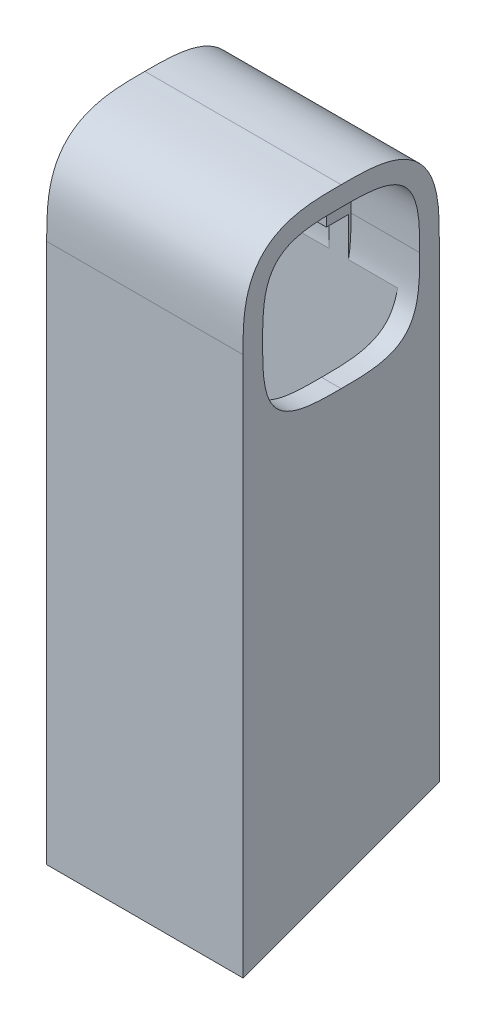
from build123d import *

# Parameters (mm, degrees)
EXTRUDE_1_DEPTH     = 20
CUT_EXTRUDE_2_DEPTH = 11
SKETCH_6_W          = 1.9
SKETCH_6_H          = 1.5
SKETCH_6_W_2        = 1.5
SKETCH_6_H_2        = 1.9
EXTRUDE_6_DEPTH     = 11
CUT_EXTRUDE_3_DEPTH = 7
CUT_EXTRUDE_4_REACH = 59.393
SKETCH_9_W          = 16
SKETCH_9_H          = 15.500151224
CUT_EXTRUDE_5_DEPTH = 60.371723314
CUT_EXTRUDE_8_DEPTH = 1.5


with BuildPart() as part:
    # 草图1 → 凸台-拉伸1 (new body)
    with BuildSketch(Plane(origin=(0, 0, 0), x_dir=(0, 0, -1), z_dir=(1, 0, 0))):
        with BuildLine():
            Line((-10, 0), (-10, -55))
            Line((-10, -55), (10, -47.720595315))
            Line((10, -47.720595315), (10, 0))
            add(Edge.make_bspline(
                [(0, 10), (0.247453809, 10), (0.758303869, 10.000016016), (1.603055308, 9.994226508), (2.593577785, 9.952211719), (3.530353928, 9.865080166), (4.284627123, 9.739256424), (4.922082116, 9.592557226), (5.422764466, 9.444615932), (5.916551912, 9.264259241), (6.394575911, 9.04867722), (6.85460463, 8.795726536), (7.271227663, 8.517584497), (7.628568885, 8.232402828), (7.946779887, 7.93562621), (8.242746957, 7.616644854), (8.528140684, 7.256833204), (8.806024166, 6.837508212), (9.057530382, 6.376839102), (9.271724392, 5.897795987), (9.450800041, 5.404655749), (9.597547811, 4.901036284), (9.744407354, 4.263402914), (9.88839272, 3.36833547), (9.983457728, 2.203757849), (9.999712963, 1.167546065), (10.000298818, 0.392340904), (10, 0)],
                knots=[0.055983789, 0.055983789, 0.055983789, 0.055983789, 0.055983789, 0.114683051, 0.173382311, 0.232081567, 0.289095869, 0.31844553, 0.347795109, 0.377144683, 0.406494377, 0.435843931, 0.465193379, 0.494543078, 0.518534158, 0.53810056, 0.562554518, 0.591904776, 0.621253575, 0.650602493, 0.679952998, 0.709301255, 0.738647221, 0.767998334, 0.826406107, 0.912140354, 1, 1, 1, 1, 1], degree=4))
            add(Edge.make_bspline(
                [(0, 10), (-0.247453809, 10), (-0.758303869, 10.000016016), (-1.603055308, 9.994226508), (-2.593577785, 9.952211719), (-3.530353928, 9.865080166), (-4.284627123, 9.739256424), (-4.922082116, 9.592557226), (-5.422764466, 9.444615932), (-5.916551912, 9.264259241), (-6.394575911, 9.04867722), (-6.85460463, 8.795726536), (-7.271227663, 8.517584497), (-7.628568885, 8.232402828), (-7.946779887, 7.93562621), (-8.242746957, 7.616644854), (-8.528140684, 7.256833204), (-8.806024166, 6.837508212), (-9.057530382, 6.376839102), (-9.271724392, 5.897795987), (-9.450800041, 5.404655749), (-9.597547811, 4.901036284), (-9.744407354, 4.263402914), (-9.88839272, 3.36833547), (-9.983457728, 2.203757849), (-9.999712963, 1.167546065), (-10.000298818, 0.392340904), (-10, 0)],
                knots=[0.055983789, 0.055983789, 0.055983789, 0.055983789, 0.055983789, 0.114683051, 0.173382311, 0.232081567, 0.289095869, 0.31844553, 0.347795109, 0.377144683, 0.406494377, 0.435843931, 0.465193379, 0.494543078, 0.518534158, 0.53810056, 0.562554518, 0.591904776, 0.621253575, 0.650602493, 0.679952998, 0.709301255, 0.738647221, 0.767998334, 0.826406107, 0.912140354, 1, 1, 1, 1, 1], degree=4))
        make_face()
    extrude(amount=EXTRUDE_1_DEPTH)

    # 草图4 → 切除-拉伸2 (cut)
    with BuildSketch(Plane.ZY):
        with BuildLine():
            add(Edge.make_bspline(
                [(0, -7.996953489), (0.165849782, -7.996953489), (0.334100831, -7.996954735), (0.676866623, -7.996002401), (0.851430156, -7.995047824), (1.198537621, -7.991293894), (1.370157566, -7.988495505), (1.702190157, -7.980267252), (1.862506084, -7.974848338), (2.177562438, -7.96056796), (2.333320862, -7.951688486), (2.645739013, -7.929639119), (2.802433419, -7.916449368), (3.110230223, -7.885378254), (3.260513804, -7.867542872), (3.55196969, -7.8266977), (3.693151717, -7.803723475), (3.975098189, -7.751014368), (4.116547995, -7.721164453), (4.388453231, -7.656261221), (4.51821518, -7.621337701), (4.773512811, -7.543946599), (4.899417217, -7.501387248), (5.141652363, -7.410259771), (5.257907453, -7.361714456), (5.820499722, -7.101159966), (6.203019186, -6.83951841), (6.842559245, -6.19997618), (7.103874532, -5.818228617), (7.52127465, -4.916762245), (7.675014245, -4.398425284), (7.885017485, -3.268209366), (7.942065616, -2.657066463), (7.999332194, -1.373354731), (8.000532588, -0.696991406), (8.00000058, 0.001523255)],
                knots=[0, 0, 0, 0, 0.03125, 0.03125, 0.0625, 0.0625, 0.09375, 0.09375, 0.125, 0.125, 0.15625, 0.15625, 0.1875, 0.1875, 0.21875, 0.21875, 0.25, 0.25, 0.28125, 0.28125, 0.3125, 0.3125, 0.34375, 0.34375, 0.375, 0.375, 0.5, 0.5, 0.625, 0.625, 0.75, 0.75, 0.875, 0.875, 1, 1, 1, 1], degree=3))
            add(Edge.make_bspline(
                [(0, 8), (0.165849782, 8), (0.334100831, 8.000001246), (0.676866623, 7.999048912), (0.851430156, 7.998094335), (1.198537621, 7.994340405), (1.370157566, 7.991542016), (1.702190157, 7.983313763), (1.862506084, 7.977894849), (2.177562438, 7.963614471), (2.333320862, 7.954734997), (2.645739013, 7.93268563), (2.802433419, 7.919495879), (3.110230223, 7.888424765), (3.260513804, 7.870589383), (3.55196969, 7.829744211), (3.693151717, 7.806769986), (3.975098189, 7.754060879), (4.116547995, 7.724210964), (4.388453231, 7.659307732), (4.51821518, 7.624384212), (4.773512811, 7.54699311), (4.899417217, 7.504433758), (5.141652363, 7.413306281), (5.257907453, 7.364760967), (5.820499722, 7.104206477), (6.203019186, 6.842564921), (6.842559245, 6.203022691), (7.103874532, 5.821275128), (7.52127465, 4.919808756), (7.675014245, 4.401471794), (7.885017485, 3.271255877), (7.942065616, 2.660112974), (7.999332194, 1.376401242), (8.000532588, 0.700037917), (8.00000058, 0.001523255)],
                knots=[0, 0, 0, 0, 0.03125, 0.03125, 0.0625, 0.0625, 0.09375, 0.09375, 0.125, 0.125, 0.15625, 0.15625, 0.1875, 0.1875, 0.21875, 0.21875, 0.25, 0.25, 0.28125, 0.28125, 0.3125, 0.3125, 0.34375, 0.34375, 0.375, 0.375, 0.5, 0.5, 0.625, 0.625, 0.75, 0.75, 0.875, 0.875, 1, 1, 1, 1], degree=3))
            add(Edge.make_bspline(
                [(-8.00000058, 0.001523255), (-8.000532588, 0.700037917), (-7.999332194, 1.376401242), (-7.942065616, 2.660112974), (-7.885017485, 3.271255877), (-7.675014245, 4.401471794), (-7.52127465, 4.919808756), (-7.103874532, 5.821275128), (-6.842559245, 6.203022691), (-6.203019186, 6.842564921), (-5.820499722, 7.104206477), (-5.257907453, 7.364760967), (-5.141652363, 7.413306281), (-4.899417217, 7.504433758), (-4.773512811, 7.54699311), (-4.51821518, 7.624384212), (-4.388453231, 7.659307732), (-4.116547995, 7.724210964), (-3.975098189, 7.754060879), (-3.693151717, 7.806769986), (-3.55196969, 7.829744211), (-3.260513804, 7.870589383), (-3.110230223, 7.888424765), (-2.802433419, 7.919495879), (-2.645739013, 7.93268563), (-2.333320862, 7.954734997), (-2.177562438, 7.963614471), (-1.862506084, 7.977894849), (-1.702190157, 7.983313763), (-1.370157566, 7.991542016), (-1.198537621, 7.994340405), (-0.851430156, 7.998094335), (-0.676866623, 7.999048912), (-0.334100831, 8.000001246), (-0.165849782, 8), (0, 8)],
                knots=[0, 0, 0, 0, 0.125, 0.125, 0.25, 0.25, 0.375, 0.375, 0.5, 0.5, 0.625, 0.625, 0.65625, 0.65625, 0.6875, 0.6875, 0.71875, 0.71875, 0.75, 0.75, 0.78125, 0.78125, 0.8125, 0.8125, 0.84375, 0.84375, 0.875, 0.875, 0.90625, 0.90625, 0.9375, 0.9375, 0.96875, 0.96875, 1, 1, 1, 1], degree=3))
            add(Edge.make_bspline(
                [(-8.00000058, 0.001523255), (-8.000532588, -0.696991406), (-7.999332194, -1.373354731), (-7.942065616, -2.657066463), (-7.885017485, -3.268209366), (-7.675014245, -4.398425284), (-7.52127465, -4.916762245), (-7.103874532, -5.818228617), (-6.842559245, -6.19997618), (-6.203019186, -6.83951841), (-5.820499722, -7.101159966), (-5.257907453, -7.361714456), (-5.141652363, -7.410259771), (-4.899417217, -7.501387248), (-4.773512811, -7.543946599), (-4.51821518, -7.621337701), (-4.388453231, -7.656261221), (-4.116547995, -7.721164453), (-3.975098189, -7.751014368), (-3.693151717, -7.803723475), (-3.55196969, -7.8266977), (-3.260513804, -7.867542872), (-3.110230223, -7.885378254), (-2.802433419, -7.916449368), (-2.645739013, -7.929639119), (-2.333320862, -7.951688486), (-2.177562438, -7.96056796), (-1.862506084, -7.974848338), (-1.702190157, -7.980267252), (-1.370157566, -7.988495505), (-1.198537621, -7.991293894), (-0.851430156, -7.995047824), (-0.676866623, -7.996002401), (-0.334100831, -7.996954735), (-0.165849782, -7.996953489), (0, -7.996953489)],
                knots=[0, 0, 0, 0, 0.125, 0.125, 0.25, 0.25, 0.375, 0.375, 0.5, 0.5, 0.625, 0.625, 0.65625, 0.65625, 0.6875, 0.6875, 0.71875, 0.71875, 0.75, 0.75, 0.78125, 0.78125, 0.8125, 0.8125, 0.84375, 0.84375, 0.875, 0.875, 0.90625, 0.90625, 0.9375, 0.9375, 0.96875, 0.96875, 1, 1, 1, 1], degree=3))
        make_face()
    extrude(amount=-CUT_EXTRUDE_2_DEPTH, mode=Mode.SUBTRACT)

    # 草图6 → 凸台-拉伸6 (add)
    with BuildSketch(Plane.ZY):
        with Locations((0, 7.75)):
            Rectangle(SKETCH_6_W, SKETCH_6_H)
        with Locations((7.75, 0)):
            Rectangle(SKETCH_6_W_2, SKETCH_6_H_2)
        with Locations((0, -7.75)):
            Rectangle(SKETCH_6_W, SKETCH_6_H)
        with Locations((-7.75, 0)):
            Rectangle(SKETCH_6_W_2, SKETCH_6_H_2)
    extrude(amount=-EXTRUDE_6_DEPTH)

    # 草图7 → 切除-拉伸3 (cut)
    with BuildSketch(Plane(origin=(20, 0, 0), x_dir=(0, 0, -1), z_dir=(1, 0, 0))):
        with BuildLine():
            add(Edge.make_bspline(
                [(0, -7.996953489), (-0.165849782, -7.996953489), (-0.334100831, -7.996954735), (-0.676866623, -7.996002401), (-0.851430156, -7.995047824), (-1.198537621, -7.991293894), (-1.370157566, -7.988495505), (-1.702190157, -7.980267252), (-1.862506084, -7.974848338), (-2.177562438, -7.96056796), (-2.333320862, -7.951688486), (-2.645739013, -7.929639119), (-2.802433419, -7.916449368), (-3.110230223, -7.885378254), (-3.260513804, -7.867542872), (-3.55196969, -7.8266977), (-3.693151717, -7.803723475), (-3.975098189, -7.751014368), (-4.116547995, -7.721164453), (-4.388453231, -7.656261221), (-4.51821518, -7.621337701), (-4.773512811, -7.543946599), (-4.899417217, -7.501387248), (-5.141652363, -7.410259771), (-5.257907453, -7.361714456), (-5.820499722, -7.101159966), (-6.203019186, -6.83951841), (-6.842559245, -6.19997618), (-7.103874532, -5.818228617), (-7.52127465, -4.916762245), (-7.675014245, -4.398425284), (-7.885017485, -3.268209366), (-7.942065616, -2.657066463), (-7.999332194, -1.373354731), (-8.000532588, -0.696991406), (-8.00000058, 0.001523255)],
                knots=[0, 0, 0, 0, 0.03125, 0.03125, 0.0625, 0.0625, 0.09375, 0.09375, 0.125, 0.125, 0.15625, 0.15625, 0.1875, 0.1875, 0.21875, 0.21875, 0.25, 0.25, 0.28125, 0.28125, 0.3125, 0.3125, 0.34375, 0.34375, 0.375, 0.375, 0.5, 0.5, 0.625, 0.625, 0.75, 0.75, 0.875, 0.875, 1, 1, 1, 1], degree=3))
            add(Edge.make_bspline(
                [(0, 8), (-0.165849782, 8), (-0.334100831, 8.000001246), (-0.676866623, 7.999048912), (-0.851430156, 7.998094335), (-1.198537621, 7.994340405), (-1.370157566, 7.991542016), (-1.702190157, 7.983313763), (-1.862506084, 7.977894849), (-2.177562438, 7.963614471), (-2.333320862, 7.954734997), (-2.645739013, 7.93268563), (-2.802433419, 7.919495879), (-3.110230223, 7.888424765), (-3.260513804, 7.870589383), (-3.55196969, 7.829744211), (-3.693151717, 7.806769986), (-3.975098189, 7.754060879), (-4.116547995, 7.724210964), (-4.388453231, 7.659307732), (-4.51821518, 7.624384212), (-4.773512811, 7.54699311), (-4.899417217, 7.504433758), (-5.141652363, 7.413306281), (-5.257907453, 7.364760967), (-5.820499722, 7.104206477), (-6.203019186, 6.842564921), (-6.842559245, 6.203022691), (-7.103874532, 5.821275128), (-7.52127465, 4.919808756), (-7.675014245, 4.401471794), (-7.885017485, 3.271255877), (-7.942065616, 2.660112974), (-7.999332194, 1.376401242), (-8.000532588, 0.700037917), (-8.00000058, 0.001523255)],
                knots=[0, 0, 0, 0, 0.03125, 0.03125, 0.0625, 0.0625, 0.09375, 0.09375, 0.125, 0.125, 0.15625, 0.15625, 0.1875, 0.1875, 0.21875, 0.21875, 0.25, 0.25, 0.28125, 0.28125, 0.3125, 0.3125, 0.34375, 0.34375, 0.375, 0.375, 0.5, 0.5, 0.625, 0.625, 0.75, 0.75, 0.875, 0.875, 1, 1, 1, 1], degree=3))
            add(Edge.make_bspline(
                [(8.00000058, 0.001523255), (8.000532588, 0.700037917), (7.999332194, 1.376401242), (7.942065616, 2.660112974), (7.885017485, 3.271255877), (7.675014245, 4.401471794), (7.52127465, 4.919808756), (7.103874532, 5.821275128), (6.842559245, 6.203022691), (6.203019186, 6.842564921), (5.820499722, 7.104206477), (5.257907453, 7.364760967), (5.141652363, 7.413306281), (4.899417217, 7.504433758), (4.773512811, 7.54699311), (4.51821518, 7.624384212), (4.388453231, 7.659307732), (4.116547995, 7.724210964), (3.975098189, 7.754060879), (3.693151717, 7.806769986), (3.55196969, 7.829744211), (3.260513804, 7.870589383), (3.110230223, 7.888424765), (2.802433419, 7.919495879), (2.645739013, 7.93268563), (2.333320862, 7.954734997), (2.177562438, 7.963614471), (1.862506084, 7.977894849), (1.702190157, 7.983313763), (1.370157566, 7.991542016), (1.198537621, 7.994340405), (0.851430156, 7.998094335), (0.676866623, 7.999048912), (0.334100831, 8.000001246), (0.165849782, 8), (0, 8)],
                knots=[0, 0, 0, 0, 0.125, 0.125, 0.25, 0.25, 0.375, 0.375, 0.5, 0.5, 0.625, 0.625, 0.65625, 0.65625, 0.6875, 0.6875, 0.71875, 0.71875, 0.75, 0.75, 0.78125, 0.78125, 0.8125, 0.8125, 0.84375, 0.84375, 0.875, 0.875, 0.90625, 0.90625, 0.9375, 0.9375, 0.96875, 0.96875, 1, 1, 1, 1], degree=3))
            add(Edge.make_bspline(
                [(8.00000058, 0.001523255), (8.000532588, -0.696991406), (7.999332194, -1.373354731), (7.942065616, -2.657066463), (7.885017485, -3.268209366), (7.675014245, -4.398425284), (7.52127465, -4.916762245), (7.103874532, -5.818228617), (6.842559245, -6.19997618), (6.203019186, -6.83951841), (5.820499722, -7.101159966), (5.257907453, -7.361714456), (5.141652363, -7.410259771), (4.899417217, -7.501387248), (4.773512811, -7.543946599), (4.51821518, -7.621337701), (4.388453231, -7.656261221), (4.116547995, -7.721164453), (3.975098189, -7.751014368), (3.693151717, -7.803723475), (3.55196969, -7.8266977), (3.260513804, -7.867542872), (3.110230223, -7.885378254), (2.802433419, -7.916449368), (2.645739013, -7.929639119), (2.333320862, -7.951688486), (2.177562438, -7.96056796), (1.862506084, -7.974848338), (1.702190157, -7.980267252), (1.370157566, -7.988495505), (1.198537621, -7.991293894), (0.851430156, -7.995047824), (0.676866623, -7.996002401), (0.334100831, -7.996954735), (0.165849782, -7.996953489), (0, -7.996953489)],
                knots=[0, 0, 0, 0, 0.125, 0.125, 0.25, 0.25, 0.375, 0.375, 0.5, 0.5, 0.625, 0.625, 0.65625, 0.65625, 0.6875, 0.6875, 0.71875, 0.71875, 0.75, 0.75, 0.78125, 0.78125, 0.8125, 0.8125, 0.84375, 0.84375, 0.875, 0.875, 0.90625, 0.90625, 0.9375, 0.9375, 0.96875, 0.96875, 1, 1, 1, 1], degree=3))
        make_face()
    extrude(amount=-CUT_EXTRUDE_3_DEPTH, mode=Mode.SUBTRACT)

    # 草图8 → 切除-拉伸4 (cut, up to next)
    with BuildSketch(Plane(origin=(13, 0, 0), x_dir=(0, 0, -1), z_dir=(1, 0, 0)), mode=Mode.PRIVATE) as cut_extrude_4_sk1:
        with BuildLine():
            add(Edge.make_bspline(
                [(0, -5.496953489), (0.408323854, -5.496953489), (0.816649183, -5.496980384), (1.632558406, -5.483517843), (2.04010607, -5.469367928), (2.853186705, -5.404340333), (3.261163856, -5.354180846), (3.860915877, -5.2123938), (4.058982713, -5.153100152), (4.342439843, -5.032838865), (4.434164209, -4.987473164), (4.608772051, -4.879841457), (4.692107393, -4.816366101), (4.906070953, -4.597714848), (5.006672586, -4.412639171), (5.162636836, -4.035364697), (5.220663184, -3.837104239), (5.360521218, -3.241025217), (5.408720727, -2.838819195), (5.472861875, -2.030954975), (5.486446534, -1.625043857), (5.50029496, -0.811798767), (5.50030958, -0.405138638), (5.499999855, 0.001523255)],
                knots=[0, 0, 0, 0, 0.125, 0.125, 0.25, 0.25, 0.375, 0.375, 0.4375, 0.4375, 0.46875, 0.46875, 0.5, 0.5, 0.5625, 0.5625, 0.625, 0.625, 0.75, 0.75, 0.875, 0.875, 1, 1, 1, 1], degree=3))
            add(Edge.make_bspline(
                [(5.499999855, 0.001523255), (5.500310914, 0.409936453), (5.500293232, 0.818331597), (5.486281535, 1.634354367), (5.472561165, 2.041997019), (5.407318554, 2.855206409), (5.357729545, 3.263498546), (5.214392423, 3.862800329), (5.155309817, 4.060912843), (5.035011511, 4.344289922), (4.989594474, 4.435968943), (4.881787257, 4.610453538), (4.81813301, 4.693626143), (4.599116112, 4.907137264), (4.413953309, 5.007504353), (4.036701836, 5.163387706), (3.83850139, 5.22154176), (3.242244432, 5.359958319), (2.840122101, 5.408736163), (2.032314196, 5.472725182), (1.626499315, 5.486718254), (0.81331153, 5.500027414), (0.40664695, 5.5), (0, 5.5)],
                knots=[0, 0, 0, 0, 0.125, 0.125, 0.25, 0.25, 0.375, 0.375, 0.4375, 0.4375, 0.46875, 0.46875, 0.5, 0.5, 0.5625, 0.5625, 0.625, 0.625, 0.75, 0.75, 0.875, 0.875, 1, 1, 1, 1], degree=3))
            add(Edge.make_bspline(
                [(0, 5.5), (-0.408323854, 5.5), (-0.816649183, 5.500026895), (-1.632558406, 5.486564354), (-2.04010607, 5.472414439), (-2.853186705, 5.407386844), (-3.261163855, 5.357227357), (-3.860915877, 5.21544031), (-4.058982713, 5.156146663), (-4.342439843, 5.035885376), (-4.434164209, 4.990519675), (-4.608772051, 4.882887968), (-4.692107393, 4.819412612), (-4.906070953, 4.600761359), (-5.006672586, 4.415685682), (-5.162636836, 4.038411208), (-5.220663184, 3.84015075), (-5.360521218, 3.244071728), (-5.408720727, 2.841865706), (-5.472861875, 2.034001486), (-5.486446534, 1.628090368), (-5.50029496, 0.814845277), (-5.50030958, 0.408185149), (-5.499999855, 0.001523255)],
                knots=[0, 0, 0, 0, 0.125, 0.125, 0.25, 0.25, 0.375, 0.375, 0.4375, 0.4375, 0.46875, 0.46875, 0.5, 0.5, 0.5625, 0.5625, 0.625, 0.625, 0.75, 0.75, 0.875, 0.875, 1, 1, 1, 1], degree=3))
            add(Edge.make_bspline(
                [(-5.499999855, 0.001523255), (-5.500310914, -0.406889942), (-5.500293232, -0.815285086), (-5.486281535, -1.631307856), (-5.472561165, -2.038950508), (-5.407318554, -2.852159898), (-5.357729545, -3.260452035), (-5.214392423, -3.859753818), (-5.155309817, -4.057866332), (-5.035011511, -4.341243411), (-4.989594474, -4.432922432), (-4.881787257, -4.607407027), (-4.81813301, -4.690579632), (-4.599116112, -4.904090753), (-4.413953309, -5.004457842), (-4.036701836, -5.160341196), (-3.83850139, -5.218495249), (-3.242244432, -5.356911808), (-2.840122101, -5.405689652), (-2.032314196, -5.469678671), (-1.626499315, -5.483671743), (-0.81331153, -5.496980903), (-0.40664695, -5.496953489), (0, -5.496953489)],
                knots=[0, 0, 0, 0, 0.125, 0.125, 0.25, 0.25, 0.375, 0.375, 0.4375, 0.4375, 0.46875, 0.46875, 0.5, 0.5, 0.5625, 0.5625, 0.625, 0.625, 0.75, 0.75, 0.875, 0.875, 1, 1, 1, 1], degree=3))
        make_face()
    cut_extrude_4_tool1 = extrude(cut_extrude_4_sk1.sketch, amount=-CUT_EXTRUDE_4_REACH, mode=Mode.PRIVATE) & part.part
    add(cut_extrude_4_tool1.solids().sort_by_distance((13, 0.001289, 0))[0], mode=Mode.SUBTRACT)

    # 草图9 → 切除-拉伸5 (cut, through all)
    with BuildSketch(Plane(origin=(0, 0, 0), x_dir=(1, 0, 0), z_dir=(0, 1, 0))):
        with Locations((10, 0)):
            Rectangle(SKETCH_9_W, SKETCH_9_H)
    extrude(amount=-CUT_EXTRUDE_5_DEPTH, mode=Mode.SUBTRACT)

    # 草图11 → 切除-拉伸8 (cut)
    with BuildSketch(Plane.ZY.offset(-5)):
        with BuildLine():
            add(Edge.make_bspline(
                [(0, -8.5), (0.681007423, -8.5), (2.079162929, -8.498942798), (3.958251284, -8.325115492), (5.645322682, -7.831728099), (6.94558105, -6.945255749), (7.832188057, -5.643552601), (8.324856479, -3.96125856), (8.498808627, -2.073275153), (8.500517427, -0.679940624), (8.499999565, 0)],
                knots=[0.055983789, 0.055983789, 0.055983789, 0.055983789, 0.173993811, 0.292003832, 0.410013853, 0.528023874, 0.646033895, 0.764043916, 0.882053938, 1.000063959, 1.000063959, 1.000063959, 1.000063959], degree=3))
            add(Edge.make_bspline(
                [(8.499999565, 0), (8.500517427, 0.679940624), (8.498808627, 2.073275153), (8.324856479, 3.96125856), (7.832188057, 5.643552601), (6.94558105, 6.945255749), (5.645322682, 7.831728099), (3.958251284, 8.325115492), (2.079162929, 8.498942798), (0.681007423, 8.5), (0, 8.5)],
                knots=[0.055983789, 0.055983789, 0.055983789, 0.055983789, 0.173993811, 0.292003832, 0.410013853, 0.528023874, 0.646033895, 0.764043916, 0.882053938, 1.000063959, 1.000063959, 1.000063959, 1.000063959], degree=3))
            add(Edge.make_bspline(
                [(0, 8.5), (-0.681007423, 8.5), (-2.079162929, 8.498942798), (-3.958251284, 8.325115492), (-5.645322682, 7.831728099), (-6.94558105, 6.945255749), (-7.832188057, 5.643552601), (-8.324856479, 3.96125856), (-8.498808627, 2.073275153), (-8.500517427, 0.679940624), (-8.499999565, 0)],
                knots=[0.055919831, 0.055919831, 0.055919831, 0.055919831, 0.173929852, 0.291939873, 0.409949894, 0.527959915, 0.645969936, 0.763979958, 0.881989979, 1, 1, 1, 1], degree=3))
            add(Edge.make_bspline(
                [(-8.499999565, 0), (-8.500517427, -0.679940624), (-8.498808627, -2.073275153), (-8.324856479, -3.96125856), (-7.832188057, -5.643552601), (-6.94558105, -6.945255749), (-5.645322682, -7.831728099), (-3.958251284, -8.325115492), (-2.079162929, -8.498942798), (-0.681007423, -8.5), (0, -8.5)],
                knots=[0.055919831, 0.055919831, 0.055919831, 0.055919831, 0.173929852, 0.291939873, 0.409949894, 0.527959915, 0.645969936, 0.763979958, 0.881989979, 1, 1, 1, 1], degree=3))
        make_face()
    extrude(amount=-CUT_EXTRUDE_8_DEPTH, mode=Mode.SUBTRACT)


solid = part.part
